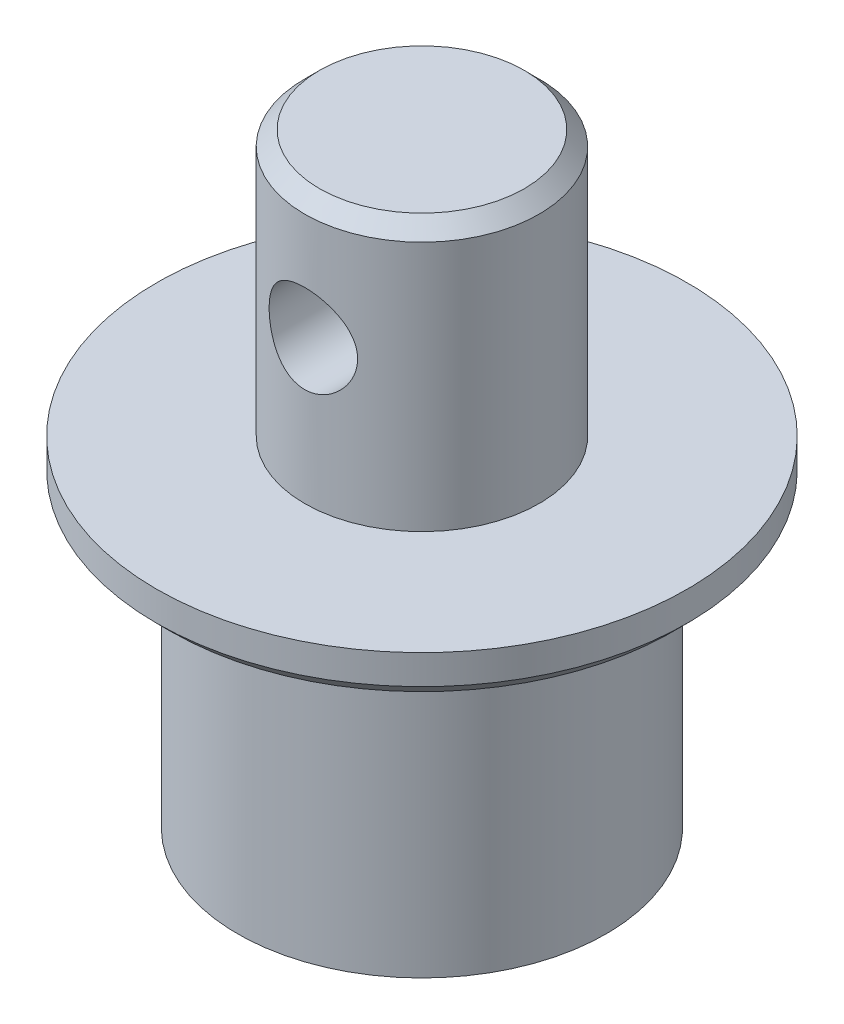
from build123d import *

# Parameters (mm, degrees)
SKETCH_1_R               = 7.95
EXTRUDE_1_DEPTH          = 18
CHAMFER_2_SIZE           = 1
SKETCH_4_R               = 18
EXTRUDE_2_DEPTH          = 3
CHAMFER_1_SIZE           = 1
SKETCH_5_R               = 12.5
EXTRUDE_3_DEPTH          = 20
CUT_EXTRUDE_2_DEPTH      = 35.307433597
CUT_EXTRUDE_2_DEPTH_BACK = 35.307433597
SKETCH_9_R               = 3
CUT_EXTRUDE_START        = 20
SKETCH_10_R              = 7.95
CUT_EXTRUDE_3_DEPTH      = 10


with BuildPart() as part:
    # 草图1 → 凸台-拉伸1 (new body)
    with BuildSketch(Plane(origin=(0, 0, 0), x_dir=(1, 0, 0), z_dir=(0, 1, 0))):
        with Locations(Location((0, 0, 0), (0, 0, 270))):
            Circle(SKETCH_1_R)
    extrude(amount=EXTRUDE_1_DEPTH)

    # 倒角2
    chamfer_2_edges = [part.edges().sort_by_distance(p)[0] for p in [
        (0, 18, -7.95),
    ]]
    chamfer(chamfer_2_edges, length=CHAMFER_2_SIZE)

    # 草图4 → 凸台-拉伸2 (add)
    with BuildSketch(Plane(origin=(0, 0, 0), x_dir=(1, 0, 0), z_dir=(0, 1, 0))):
        with Locations(Location((0, 0, 0), (0, 0, 270))):
            Circle(SKETCH_4_R)
    extrude(amount=-EXTRUDE_2_DEPTH)

    # 倒角1
    chamfer_1_edges = [part.edges().sort_by_distance(p)[0] for p in [
        (0, -3, -18),
    ]]
    chamfer(chamfer_1_edges, length=CHAMFER_1_SIZE)

    # 草图5 → 凸台-拉伸3 (add)
    with BuildSketch(Plane(origin=(0, -3, 0), x_dir=(-1, 0, 0), z_dir=(0, -1, 0))):
        with Locations(Location((0, 0, 0), (0, 0, 90))):
            Circle(SKETCH_5_R)
    extrude(amount=EXTRUDE_3_DEPTH)

    # 草图9 → 切除-拉伸2 (cut, two sides: drawn at the far end of the back side and taken through both)
    with BuildSketch(Plane.XY.offset(-CUT_EXTRUDE_2_DEPTH_BACK)):
        with Locations(Location((0, 9.7, 0), (0, 0, 89.999999999))):
            Circle(SKETCH_9_R)
    extrude(amount=CUT_EXTRUDE_2_DEPTH + CUT_EXTRUDE_2_DEPTH_BACK, mode=Mode.SUBTRACT)

    # 草图10 → 切除-拉伸3 (cut)
    with BuildSketch(Plane(origin=(0, -3, 0), x_dir=(-1, 0, 0), z_dir=(0, -1, 0)).offset(CUT_EXTRUDE_START)):
        with Locations(Location((0, 0, 0), (0, 0, 270))):
            Circle(SKETCH_10_R)
    extrude(amount=-CUT_EXTRUDE_3_DEPTH, mode=Mode.SUBTRACT)


solid = part.part
